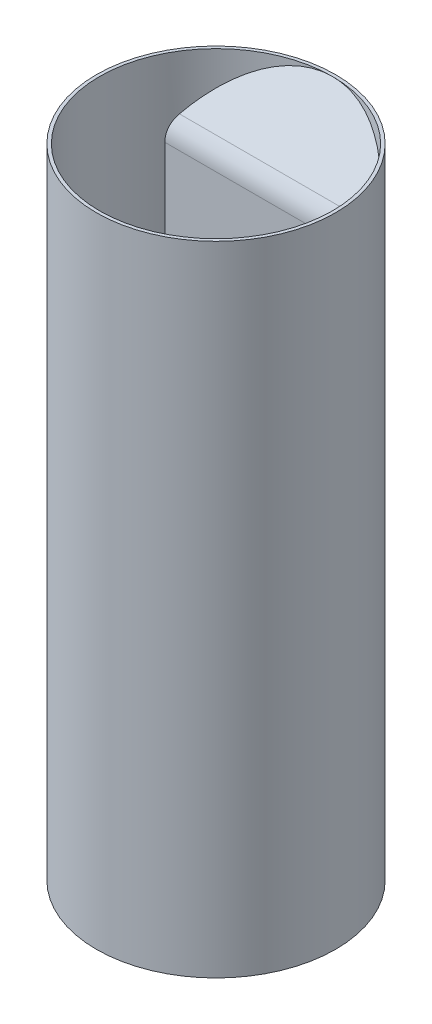
from build123d import *

# Parameters (mm, degrees)
SCHIZZO1_R                   = 37.5
ESTRUSIONE_ESTRUSIONE1_DEPTH = 200
TAGLIO_ESTRUSIONE2_DEPTH     = 207.911816966
SMUSSO3_SIZE                 = 20
RACCORDO1_R                  = 10


with BuildPart() as part:
    # Schizzo1 → Estrusione-Estrusione1 (new body)
    with BuildSketch(Plane(origin=(0, 0, 0), x_dir=(-1, 0, 0), z_dir=(0, 1, 0))):
        with Locations(Location((0, 0, 0), (0, 0, 90))):
            Circle(SCHIZZO1_R)
    extrude(amount=ESTRUSIONE_ESTRUSIONE1_DEPTH)

    # Schizzo2 → Taglio-Estrusione2 (cut, through all)
    with BuildSketch(Plane(origin=(0, 200, 0), x_dir=(-1, 0, 0), z_dir=(0, 1, 0))):
        with BuildLine():
            ThreePointArc((36.5, 0), (-8.482219535, 35.500731707), (-32.557641192, -16.5))
            Line((-32.557641192, -16.5), (32.557641192, -16.5))
            ThreePointArc((32.557641192, -16.5), (35.500731707, -8.482219535), (36.5, 0))
        make_face()
    extrude(amount=-TAGLIO_ESTRUSIONE2_DEPTH, mode=Mode.SUBTRACT)

    # Smusso3
    smusso3_edges = [part.edges().sort_by_distance(p)[0] for p in [
        (0, 0, -16.5),
        (0, 200, -16.5),
    ]]
    chamfer(smusso3_edges, length=SMUSSO3_SIZE)

    # Raccordo1
    raccordo1_edges = [part.edges().sort_by_distance(p)[0] for p in [
        (0, 20, -16.5),
        (0, 180, -16.5),
    ]]
    fillet(raccordo1_edges, radius=RACCORDO1_R)


solid = part.part
